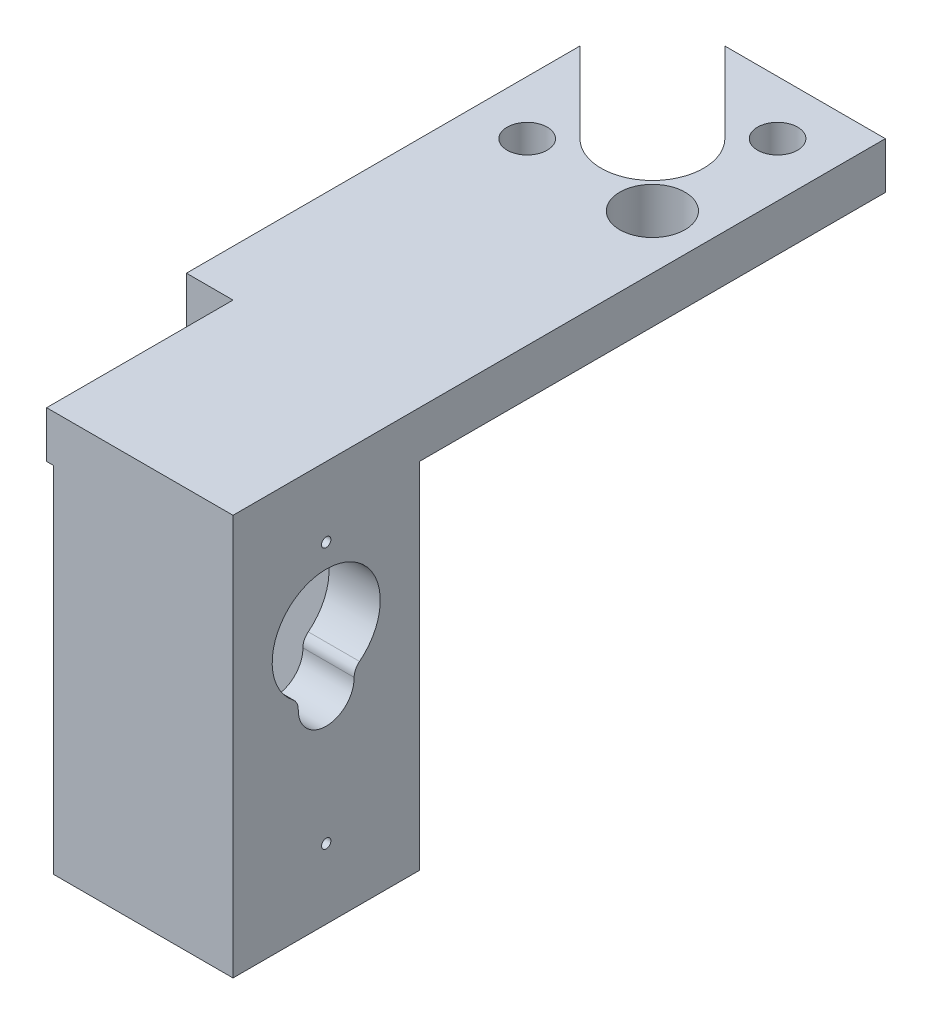
from build123d import *

# Parameters (mm, degrees)
SKETCH1_R               = 2.15
BOSS_EXTRUDE1_DEPTH     = 5
SKETCH2_W               = 20
SKETCH2_H               = 38
BOSS_EXTRUDE2_DEPTH     = 5.5
BOSS_EXTRUDE3_START     = -5.5
SKETCH2_3_W             = 12
SKETCH2_3_H             = 5
BOSS_EXTRUDE3_DEPTH     = 1.75
BOSS_EXTRUDE4_START     = -7.25
BOSS_EXTRUDE4_DEPTH     = 12
CUT_EXTRUDE1_DEPTH      = 327.38055291
CUT_EXTRUDE1_DEPTH_BACK = 327.38055291
SKETCH3_W               = 5
SKETCH3_H               = 20
CUT_EXTRUDE2_DEPTH      = 499.511572812
CUT_EXTRUDE2_DEPTH_BACK = 499.511572812
SKETCH4_R               = 0.5


with BuildPart() as part:
    # Sketch1 → Boss-Extrude1 (new body)
    # profile 1 of 2: a face of its own
    with BuildSketch(Plane(origin=(0, 374.684836729, 0), x_dir=(1, 0, 0), z_dir=(0, 1, 0))):
        with BuildLine():
            Line((-17.462959124, -252.549454326), (-16.552371089, -253.460042361))
            ThreePointArc((-16.552371089, -253.460042361), (-5.587711318, -255.166714424), (-0.541133717, -265.049454326))
            ThreePointArc((-0.541133717, -265.049454326), (-1.047348087, -268.52729527), (-2.52398251, -271.716524237))
            ThreePointArc((-2.52398251, -271.716524237), (-2.523709833, -271.741746877), (-2.523618939, -271.766970826))
            ThreePointArc((-2.523618939, -271.766970826), (-3.566645822, -274.25961663), (-6.074066426, -275.266607243))
            ThreePointArc((-6.074066426, -275.266607243), (-20.174592051, -274.723321041), (-24.330545682, -261.238216954))
            Line((-24.330545682, -261.238216954), (-25.241133717, -260.327628919))
            Line((-25.241133717, -260.327628919), (-25.241133717, -322.549454326))
            Line((-25.241133717, -322.549454326), (-0.241133717, -322.549454326))
            Line((-0.241133717, -322.549454326), (-0.241133717, -252.549454326))
            Line((-0.241133717, -252.549454326), (-17.462959124, -252.549454326))
        make_face()
    # profile 2 of 2: a face of its own
    with BuildSketch(Plane(origin=(0, 374.684836729, 0), x_dir=(1, 0, 0), z_dir=(0, 1, 0))):
        with BuildLine():
            Line((-16.552371089, -253.460042361), (-8.852046421, -261.16036703))
            ThreePointArc((-8.852046421, -261.16036703), (-7.659796289, -262.944695448), (-7.241133717, -265.049454326))
            ThreePointArc((-7.241133717, -265.049454326), (-10.636374839, -270.130791755), (-16.630221014, -268.938541623))
            Line((-16.630221014, -268.938541623), (-24.330545682, -261.238216954))
            ThreePointArc((-24.330545682, -261.238216954), (-20.174592051, -274.723321041), (-6.074066426, -275.266607243))
            ThreePointArc((-6.074066426, -275.266607243), (-8.498492356, -269.292096775), (-2.52398251, -271.716524237))
            ThreePointArc((-2.52398251, -271.716524237), (-1.047348087, -268.52729527), (-0.541133717, -265.049454326))
            ThreePointArc((-0.541133717, -265.049454326), (-5.587711318, -255.166714424), (-16.552371089, -253.460042361))
        make_face()
        with Locations(Location((-19.458649, -271.766967887, 0), (0, 0, 270))):
            Circle(SKETCH1_R, mode=Mode.SUBTRACT)
        with Locations(Location((-6.023618435, -258.331940766, 0), (0, 0, 270))):
            Circle(SKETCH1_R, mode=Mode.SUBTRACT)
    extrude(amount=BOSS_EXTRUDE1_DEPTH)

    # Sketch2 → Boss-Extrude2 (add)
    with BuildSketch(Plane(origin=(-0.241133717, 0, 0), x_dir=(0, 0, -1), z_dir=(1, 0, 0))):
        with Locations((-312.549454326, 355.684836729)):
            Rectangle(SKETCH2_W, SKETCH2_H)
        with BuildLine():
            ThreePointArc((-308.974348052, 359.317713441), (-309.402003012, 358.785726579), (-309.54965251, 358.119319487))
            ThreePointArc((-309.54965251, 358.119319487), (-312.549454326, 355.084836729), (-315.549256143, 358.119319487))
            ThreePointArc((-315.549256143, 358.119319487), (-315.696905641, 358.785726579), (-316.124560601, 359.317713441))
            ThreePointArc((-316.124560601, 359.317713441), (-312.549454326, 369.684836729), (-308.974348052, 359.317713441))
        make_face(mode=Mode.SUBTRACT)
    extrude(amount=-BOSS_EXTRUDE2_DEPTH)

    # Sketch2<3> → Boss-Extrude3 (add)
    with BuildSketch(Plane(origin=(-0.241133717, 0, 0), x_dir=(0, 0, -1), z_dir=(1, 0, 0)).offset(BOSS_EXTRUDE3_START)):
        Polygon((-318.549454326, 374.684836729), (-322.549454326, 374.684836729), (-322.549454326, 336.684836729), (-302.549454326, 336.684836729), (-302.549454326, 374.684836729), (-306.549454326, 374.684836729), (-306.549454326, 369.684836729), (-306.549454326, 346.684836729), (-306.549454326, 341.684836729), (-318.549454326, 341.684836729), (-318.549454326, 346.684836729), (-318.549454326, 369.684836729), align=None)
        with Locations((-312.549454326, 344.184836729)):
            Rectangle(SKETCH2_3_W, SKETCH2_3_H)
        Polygon((-306.549454326, 374.684836729), (-318.549454326, 374.684836729), (-318.549454326, 369.684836729), (-312.549454326, 369.684836729), (-306.549454326, 369.684836729), align=None)
    extrude(amount=-BOSS_EXTRUDE3_DEPTH)

    # Sketch2<4> → Boss-Extrude4 (add)
    with BuildSketch(Plane(origin=(-0.241133717, 0, 0), x_dir=(0, 0, -1), z_dir=(1, 0, 0)).offset(BOSS_EXTRUDE4_START)):
        Polygon((-318.549454326, 374.684836729), (-322.549454326, 374.684836729), (-322.549454326, 336.684836729), (-302.549454326, 336.684836729), (-302.549454326, 374.684836729), (-306.549454326, 374.684836729), (-306.549454326, 369.684836729), (-306.549454326, 346.684836729), (-306.549454326, 341.684836729), (-318.549454326, 341.684836729), (-318.549454326, 346.684836729), (-318.549454326, 369.684836729), align=None)
    extrude(amount=-BOSS_EXTRUDE4_DEPTH)

    # Sketch3 → Cut-Extrude1 (cut, two sides: drawn at the far end of the back side and taken through both)
    with BuildSketch(Plane(origin=(0, 379.684836729, 0), x_dir=(1, 0, 0), z_dir=(0, 1, 0)).offset(-CUT_EXTRUDE1_DEPTH_BACK)):
        with Locations((-22.741133717, -312.549454326)):
            Rectangle(SKETCH3_W, SKETCH3_H)
    extrude(amount=CUT_EXTRUDE1_DEPTH + CUT_EXTRUDE1_DEPTH_BACK, mode=Mode.SUBTRACT)

    # Sketch4 → Cut-Extrude2 (cut, two sides: drawn at the far end of the back side and taken through both)
    with BuildSketch(Plane.ZY.offset(7.491133717).offset(-CUT_EXTRUDE2_DEPTH_BACK)):
        with Locations(Location((312.549454326, 372.184836729, 0), (0, 0, 270))):
            Circle(SKETCH4_R)
        with Locations(Location((312.549454326, 344.184836729, 0), (0, 0, 270))):
            Circle(SKETCH4_R)
    extrude(amount=CUT_EXTRUDE2_DEPTH + CUT_EXTRUDE2_DEPTH_BACK, mode=Mode.SUBTRACT)


solid = part.part
